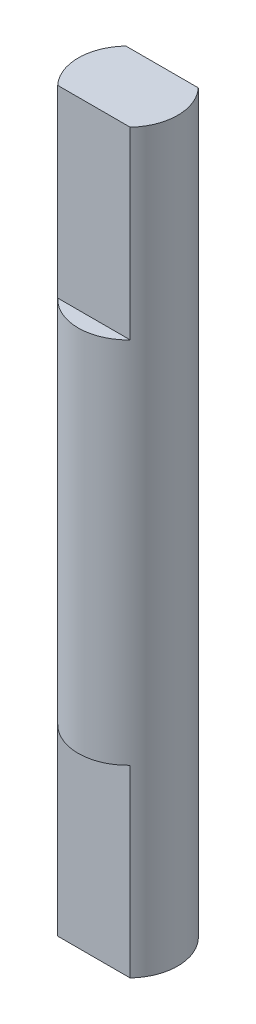
from build123d import *

# Parameters (mm, degrees)
CROQUIS1_R              = 2.7
SALIENTE_EXTRUIR1_DEPTH = 10
SALIENTE_EXTRUIR2_START = 10
SALIENTE_EXTRUIR2_DEPTH = 10


with BuildPart() as part:
    # Croquis1 → Saliente-Extruir1 (new, symmetric)
    with BuildSketch(Plane(origin=(0, 0, 0), x_dir=(1, 0, 0), z_dir=(0, 1, 0))):
        with Locations(Location((0, 0, 0), (0, 0, 270))):
            Circle(CROQUIS1_R)
    extrude(amount=SALIENTE_EXTRUIR1_DEPTH, both=True)

    # Croquis2 → Saliente-Extruir2 (add)
    with BuildSketch(Plane(origin=(0, 10, 0), x_dir=(1, 0, 0), z_dir=(0, 1, 0)).offset(SALIENTE_EXTRUIR2_START)):
        with BuildLine():
            Line((1.966596044, 1.85), (-1.966596044, 1.85))
            ThreePointArc((-1.966596044, 1.85), (-2.7, 0), (-1.966596044, -1.85))
            Line((-1.966596044, -1.85), (1.966596044, -1.85))
            ThreePointArc((1.966596044, -1.85), (2.7, 0), (1.966596044, 1.85))
        make_face()
    saliente_extruir2 = extrude(amount=-SALIENTE_EXTRUIR2_DEPTH)

    # Simetría1: Saliente-Extruir2 across plane
    add(saliente_extruir2.mirror(Plane.ZX))


solid = part.part
